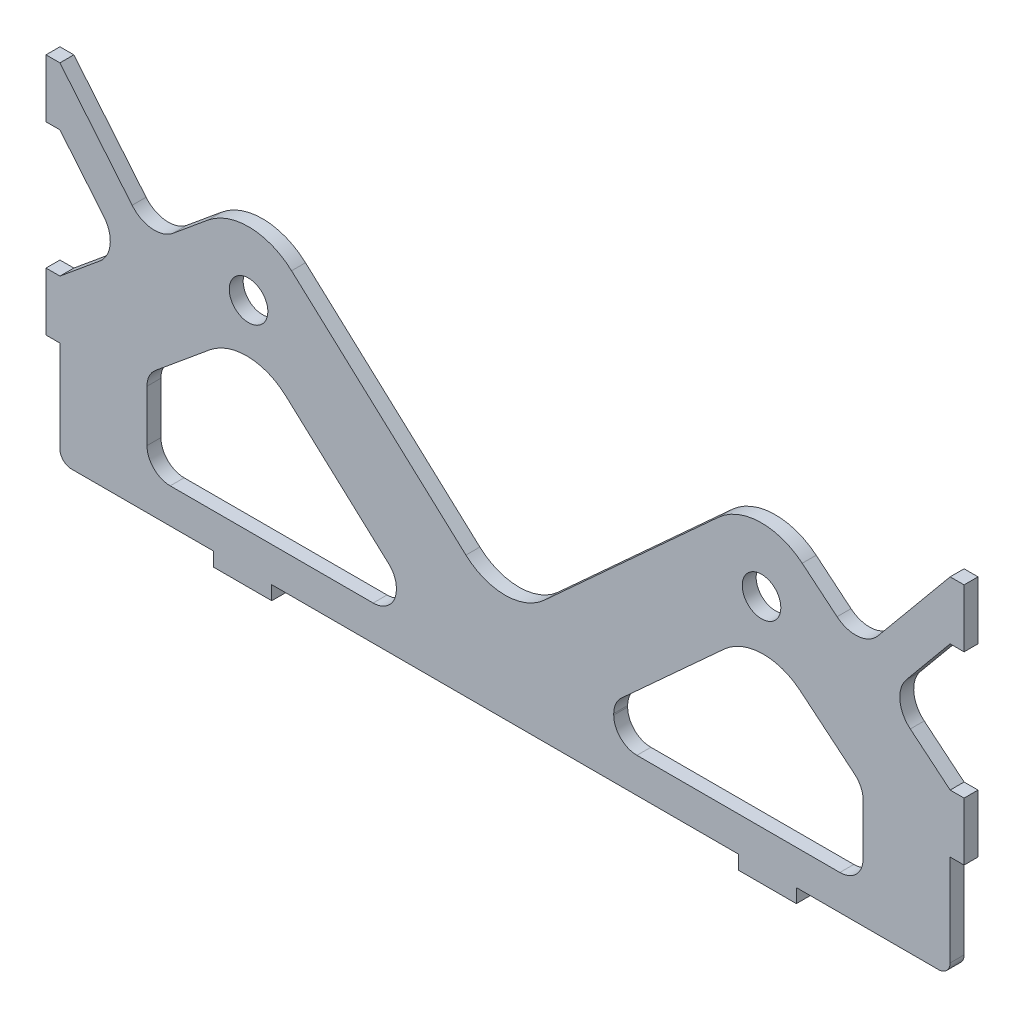
from build123d import *

# Parameters (mm, degrees)
SKETCH1_R            = 4.22275
BOSS_EXTRUDE1_DEPTH  = 3.048
FILLET1_R            = 12.7
CUT_EXTRUDE1_DEPTH   = 120.852046006
FILLET2_R            = 5.08
FILLET2_OF_MIRROR1_R = 5.08
BOSS_EXTRUDE2_DEPTH  = 3.048
FILLET4_R            = 6.35


with BuildPart() as part:
    # Sketch1 → Boss-Extrude1 (new body)
    with BuildSketch(Plane.XY):
        with BuildLine():
            Line((51.054, 0), (-51.054, 0))
            Line((-51.054, 0), (-51.054, -3.048))
            Line((-51.054, -3.048), (-63.754, -3.048))
            Line((-63.754, -3.048), (-63.754, 0))
            Line((-63.754, 0), (-94.861600757, 0))
            ThreePointArc((-94.861600757, 0), (-96.657651981, 0.743948776), (-97.401600757, 2.54))
            Line((-97.401600757, 2.54), (-97.401600757, 22.606))
            Line((-97.401600757, 22.606), (-100.449600757, 22.606))
            Line((-100.449600757, 22.606), (-100.449600757, 35.306))
            Line((-100.449600757, 35.306), (-97.401600757, 35.306))
            Line((-97.401600757, 35.306), (-65.034740931, 62.09905242))
            ThreePointArc((-65.034740931, 62.09905242), (-55.791114337, 65.303706753), (-46.712023238, 61.658909525))
            Line((-46.712023238, 61.658909525), (0, 19.05))
            Line((0, 19.05), (46.712023238, 61.658909525))
            ThreePointArc((46.712023238, 61.658909525), (55.791114337, 65.303706753), (65.034740931, 62.09905242))
            Line((65.034740931, 62.09905242), (97.401600757, 35.306))
            Line((97.401600757, 35.306), (100.449600757, 35.306))
            Line((100.449600757, 35.306), (100.449600757, 22.606))
            Line((100.449600757, 22.606), (97.401600757, 22.606))
            Line((97.401600757, 22.606), (97.401600757, 2.54))
            ThreePointArc((97.401600757, 2.54), (96.657651981, 0.743948776), (94.861600757, 0))
            Line((94.861600757, 0), (63.754, 0))
            Line((63.754, 0), (63.754, -3.048))
            Line((63.754, -3.048), (51.054, -3.048))
            Line((51.054, -3.048), (51.054, 0))
        make_face()
        with Locations((56.126600757, 51.33773565)):
            Circle(SKETCH1_R, mode=Mode.SUBTRACT)
        with Locations((-56.126600757, 51.33773565)):
            Circle(SKETCH1_R, mode=Mode.SUBTRACT)
    extrude(amount=-BOSS_EXTRUDE1_DEPTH)

    # Fillet1
    fillet1_edges = [part.edges().sort_by_distance(p)[0] for p in [
        (0, 19.05, -1.524),
    ]]
    fillet(fillet1_edges, radius=FILLET1_R)

    # Sketch3 → Cut-Extrude1 (cut, symmetric)
    with BuildSketch(Plane.XY):
        with BuildLine():
            Line((-64.628984538, 37.704829039), (-78.351600757, 26.345346603))
            Line((-78.351600757, 26.345346603), (-78.351600757, 7.62))
            Line((-78.351600757, 7.62), (-23.782503148, 7.62))
            Line((-23.782503148, 7.62), (-23.782503148, 15.24))
            Line((-23.782503148, 15.24), (-47.971968454, 37.304699134))
            ThreePointArc((-47.971968454, 37.304699134), (-56.225687634, 40.61815116), (-64.628984538, 37.704829039))
        make_face()
    cut_extrude1 = extrude(amount=CUT_EXTRUDE1_DEPTH, both=True, mode=Mode.SUBTRACT)

    # Fillet2
    fillet2_edges = [part.edges().sort_by_distance(p)[0] for p in [
        (-23.782503148, 15.24, -1.524),
        (-23.782503148, 7.62, -1.524),
        (-78.351600757, 7.62, -1.524),
        (-78.351600757, 26.345346603, -1.524),
    ]]
    fillet(fillet2_edges, radius=FILLET2_R)

    # Mirror1: Cut-Extrude1 across plane
    add(cut_extrude1.mirror(Plane(origin=(0, 0, 0), x_dir=(0, 0, 1), z_dir=(1, 0, 0))), mode=Mode.SUBTRACT)

    # Fillet2 of Mirror1
    fillet2_of_mirror1_edges = [part.edges().sort_by_distance(p)[0] for p in [
        (23.782503148, 15.24, -1.524),
        (23.782503148, 7.62, -1.524),
        (78.351600757, 7.62, -1.524),
        (78.351600757, 26.345346603, -1.524),
    ]]
    fillet(fillet2_of_mirror1_edges, radius=FILLET2_OF_MIRROR1_R)

    # Sketch4 → Boss-Extrude2 (add)
    with BuildSketch(Plane.XY):
        Polygon((-97.401600757, 75.714336407), (-77.552967075, 51.736555375), (-83.791225568, 46.572570123), (-97.401600757, 63.014336407), (-100.449600757, 63.014336407), (-100.449600757, 75.714336407), align=None)
    boss_extrude2 = extrude(amount=-BOSS_EXTRUDE2_DEPTH)

    # Mirror3: Boss-Extrude2 across plane
    add(boss_extrude2.mirror(Plane(origin=(0, 0, 0), x_dir=(0, 0, 1), z_dir=(1, 0, 0))))

    # Fillet4
    fillet4_edges = [part.edges().sort_by_distance(p)[0] for p in [
        (-77.552967075, 51.736555375, -1.524),
        (-83.791225568, 46.572570123, -1.524),
        (77.552967075, 51.736555375, -1.524),
        (83.791225568, 46.572570123, -1.524),
    ]]
    fillet(fillet4_edges, radius=FILLET4_R)


solid = part.part
